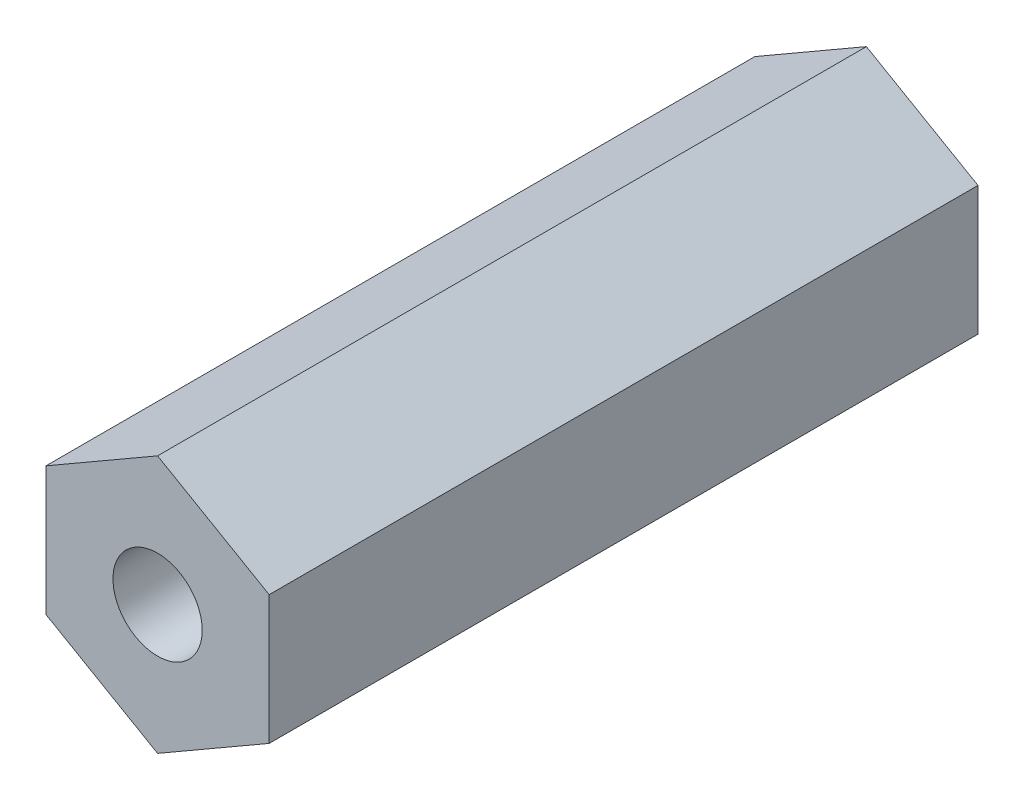
from build123d import *

# Parameters (mm, degrees)
BOSS_EXTRUDE1_DEPTH = 20.17
SKETCH2_R           = 2.54
CUT_EXTRUDE1_DEPTH  = 42.489775046


with BuildPart() as part:
    # Sketch1 → Boss-Extrude1 (new, symmetric)
    with BuildSketch(Plane.XY):
        Polygon((6.35, 3.666174209), (0, 7.332348419), (-6.35, 3.666174209), (-6.35, -3.666174209), (0, -7.332348419), (6.35, -3.666174209), align=None)
    extrude(amount=BOSS_EXTRUDE1_DEPTH, both=True)

    # Sketch2 → Cut-Extrude1 (cut, through all)
    with BuildSketch(Plane.XY.offset(20.17)):
        Circle(SKETCH2_R)
    extrude(amount=-CUT_EXTRUDE1_DEPTH, mode=Mode.SUBTRACT)


solid = part.part
